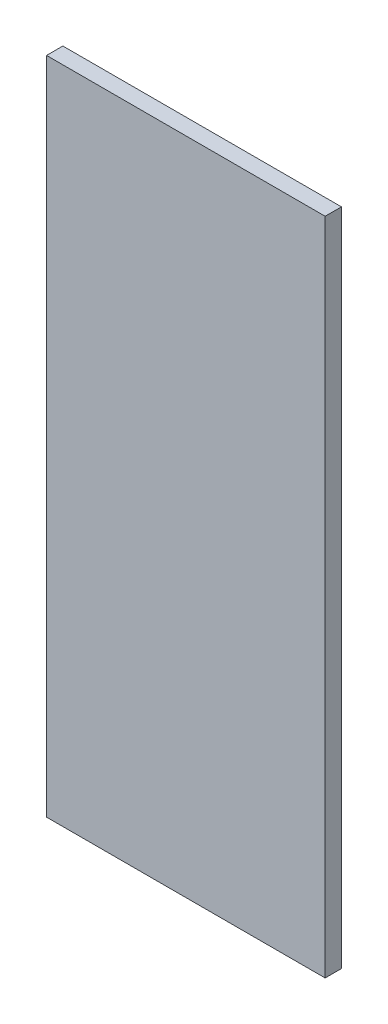
from build123d import *

# Parameters (mm, degrees)
SKETCH1_W           = 173.746858425
SKETCH1_H           = 411.430597606
BOSS_EXTRUDE1_DEPTH = 10.16


with BuildPart() as part:
    # Sketch1 → Boss-Extrude1 (new body)
    with BuildSketch(Plane.XY):
        with Locations((247.462170081, -205.715298803)):
            Rectangle(SKETCH1_W, SKETCH1_H)
    extrude(amount=BOSS_EXTRUDE1_DEPTH)


solid = part.part
